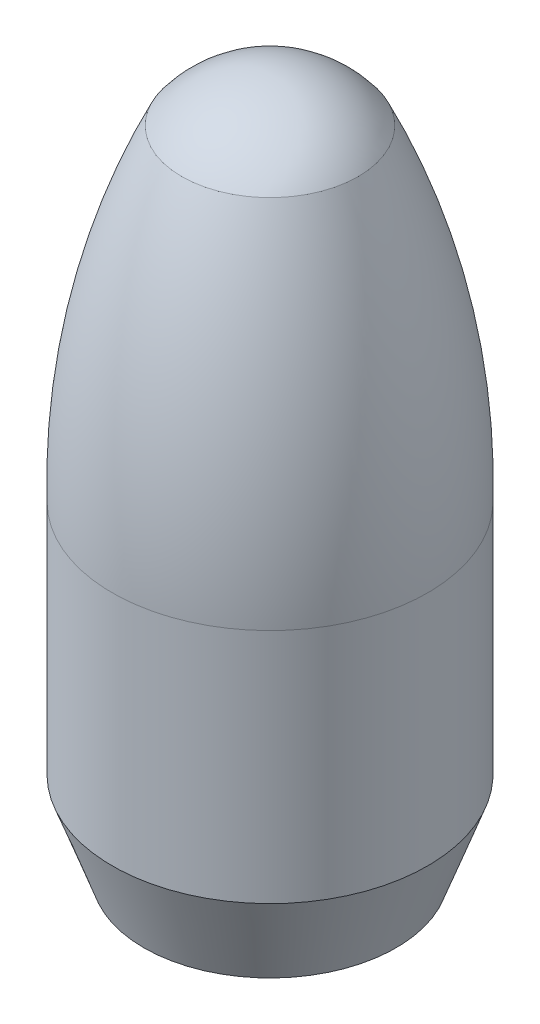
from build123d import *

# Parameters (mm, degrees)
DOME1_FACE_RADIUS = 78.4
DOME1_HEIGHT      = 39.2


with BuildPart() as part:
    # Sketch1 → Revolve1 (revolve)
    with BuildSketch(Plane.XY, mode=Mode.PRIVATE) as revolve1_sk:
        with BuildLine():
            Line((140, 287), (140, 77))
            Line((140, 77), (112, 0))
            Line((112, 0), (0, 0))
            Line((0, 0), (0, 576.450091372))
            Line((0, 576.450091372), (78.4, 576.450091372))
            ThreePointArc((78.4, 576.450091372), (126.225805609, 435.348432435), (140, 287))
        make_face()
    revolve(revolve1_sk.sketch.rotate(Axis((0, 0, 0), (0, 1, 0)), 90), axis=Axis((0, 0, 0), (0, 1, 0)))

    # Dome1: a dome of height H over a round flat face of radius A is a cap of a sphere of radius (A * A + H * H) / (2 * H)
    dome1_r = (DOME1_FACE_RADIUS * DOME1_FACE_RADIUS + DOME1_HEIGHT * DOME1_HEIGHT) / (2 * DOME1_HEIGHT)
    dome1_base = Plane((0, 576.450091372, 0), z_dir=(0, 1, 0))
    with Locations(dome1_base.offset(DOME1_HEIGHT - dome1_r)):
        dome1_ball = Sphere(dome1_r, mode=Mode.PRIVATE)
    add(split(dome1_ball, bisect_by=dome1_base, keep=Keep.TOP, mode=Mode.PRIVATE))


solid = part.part
